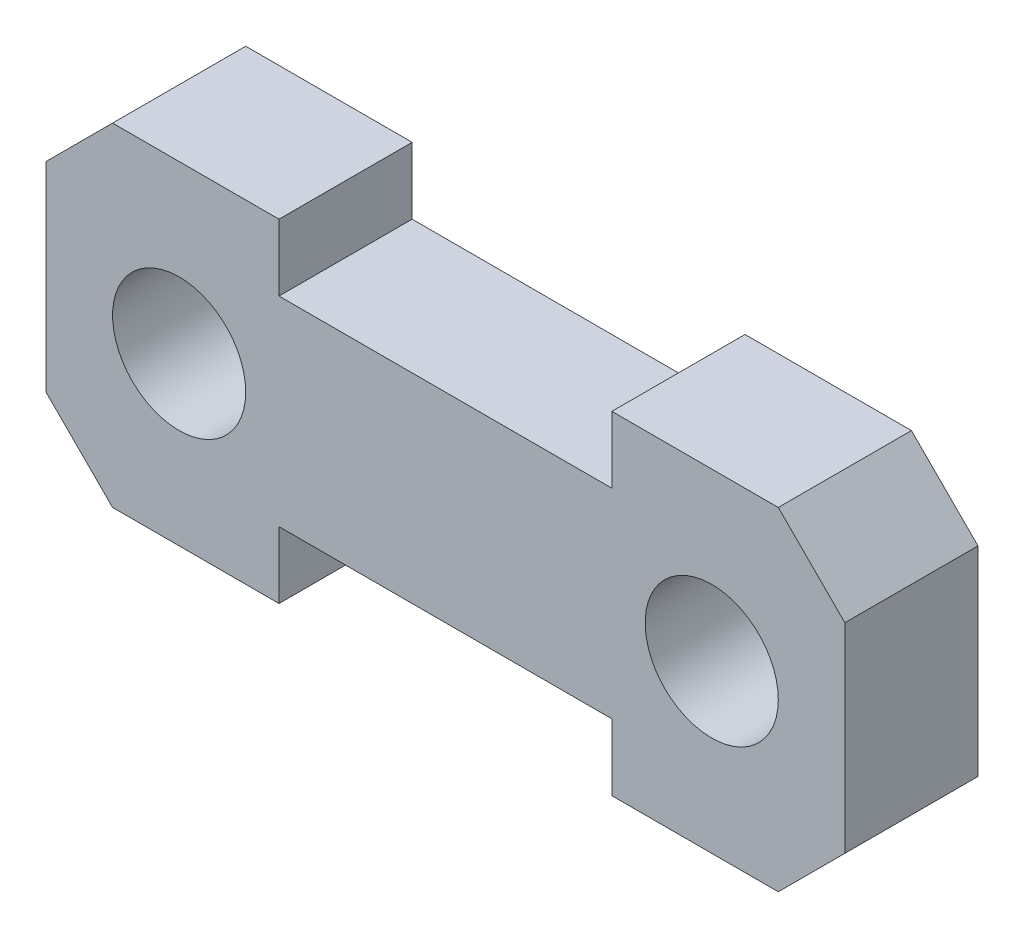
from build123d import *

# Parameters (mm, degrees)
SKETCH_1_R      = 1
EXTRUDE_1_DEPTH = 2


with BuildPart() as part:
    # 草图1 → 凸台-拉伸1 (new body)
    with BuildSketch(Plane.XY):
        Polygon((-2.5, 2.5), (-2.5, 1.5), (2.5, 1.5), (2.5, 2.5), (5, 2.5), (6, 1.5), (6, -1.5), (5, -2.5), (2.5, -2.5), (2.5, -1.5), (-2.5, -1.5), (-2.5, -2.5), (-5, -2.5), (-6, -1.5), (-6, 1.5), (-5, 2.5), align=None)
        with Locations((-4, 0)):
            Circle(SKETCH_1_R, mode=Mode.SUBTRACT)
        with Locations((4, 0)):
            Circle(SKETCH_1_R, mode=Mode.SUBTRACT)
    extrude(amount=EXTRUDE_1_DEPTH)


solid = part.part
